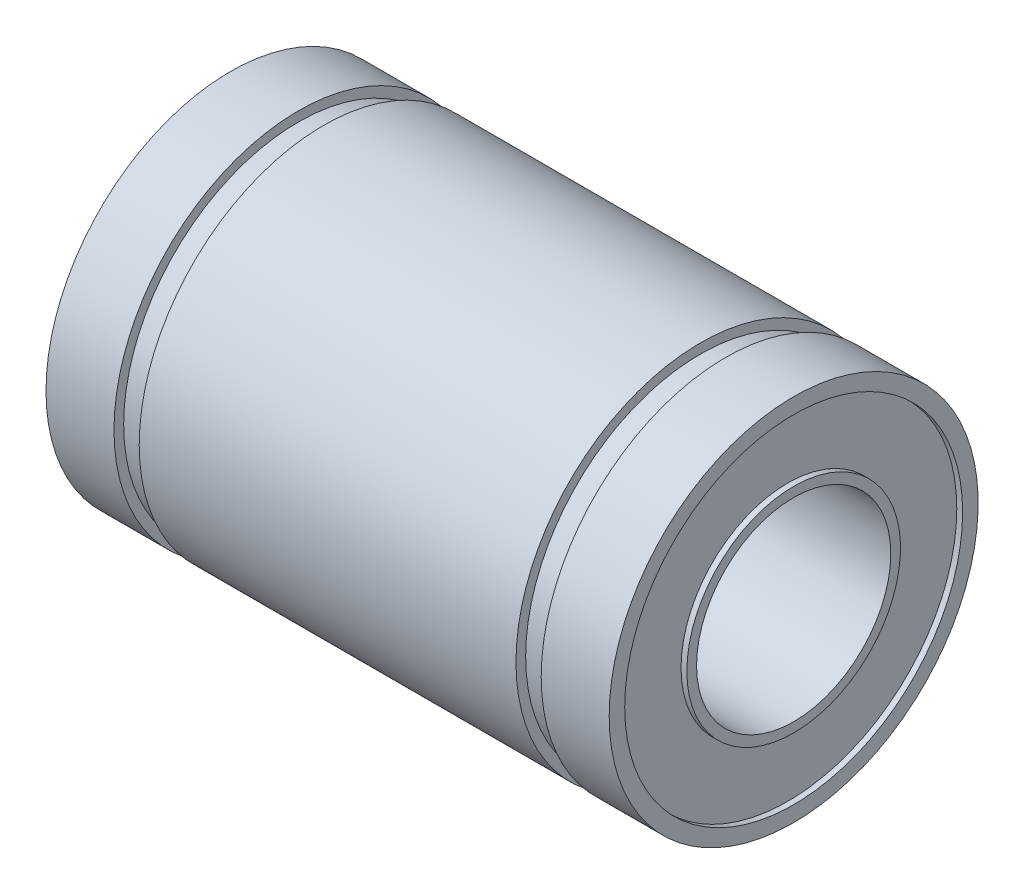
from build123d import *


with BuildPart() as part:
    # Sketch1 → Revolve1 (revolve)
    with BuildSketch(Plane.XY, mode=Mode.PRIVATE) as revolve1_sk:
        Polygon((-14.5, 5), (14.5, 5), (14.5, 5.5), (14.2, 5.5), (14.2, 8.7), (14.5, 8.7), (14.5, 9.5), (11, 9.5), (11, 9), (9.7, 9), (9.7, 9.5), (-9.7, 9.5), (-9.7, 9), (-11, 9), (-11, 9.5), (-14.5, 9.5), (-14.5, 8.7), (-14.2, 8.7), (-14.2, 5.5), (-14.5, 5.5), align=None)
    revolve(revolve1_sk.sketch.rotate(Axis((-14.5, 0, 0), (1, 0, 0)), 90), axis=Axis((-14.5, 0, 0), (1, 0, 0)))


solid = part.part
